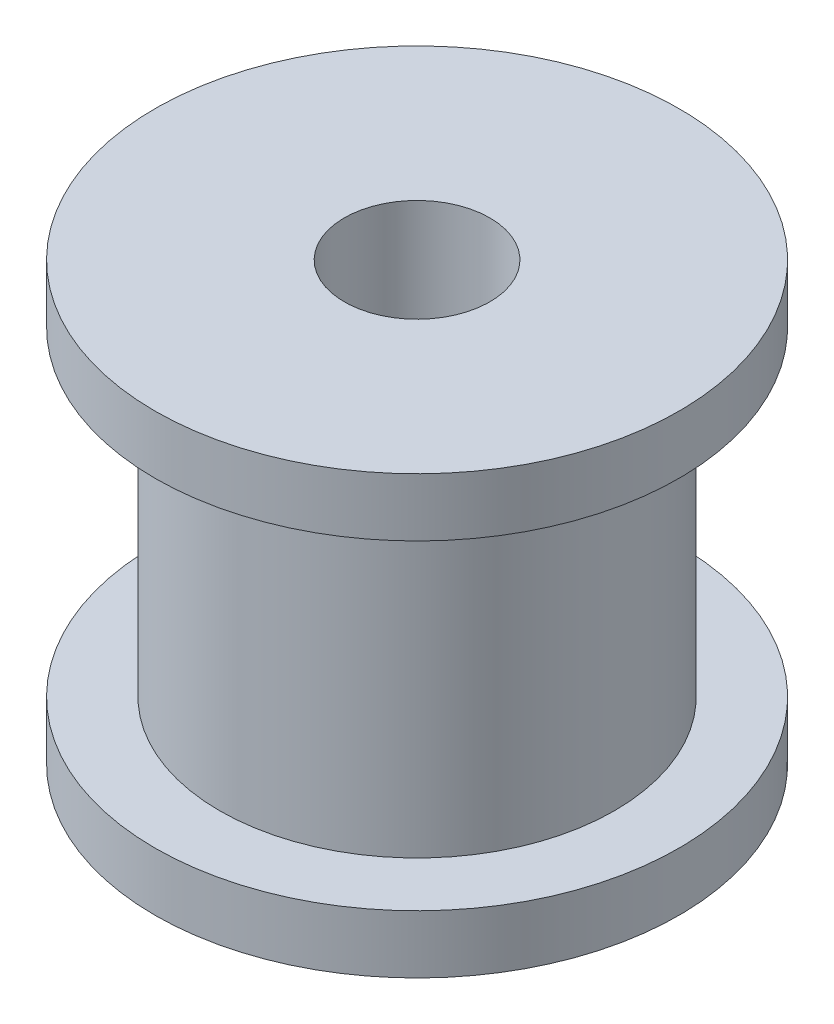
from build123d import *

# Parameters (mm, degrees)
SKETCH_1_R          = 9
EXTRUDE_1_DEPTH     = 2
SKETCH_2_R          = 6.78
EXTRUDE_2_DEPTH     = 11
SKETCH_3_R          = 9
EXTRUDE_3_DEPTH     = 2
SKETCH_5_R          = 2.5
CUT_EXTRUDE_1_DEPTH = 20.672315573


with BuildPart() as part:
    # 草图1 → 凸台-拉伸1 (new body)
    with BuildSketch(Plane(origin=(0, 0, 0), x_dir=(1, 0, 0), z_dir=(0, 1, 0))):
        with Locations(Location((0, 0, 0), (0, 0, 270))):
            Circle(SKETCH_1_R)
    extrude(amount=EXTRUDE_1_DEPTH)

    # 草图2 → 凸台-拉伸2 (add)
    with BuildSketch(Plane(origin=(0, 2, 0), x_dir=(1, 0, 0), z_dir=(0, 1, 0))):
        with Locations(Location((0, 0, 0), (0, 0, 270))):
            Circle(SKETCH_2_R)
    extrude(amount=EXTRUDE_2_DEPTH)

    # 草图3 → 凸台-拉伸3 (add)
    with BuildSketch(Plane(origin=(0, 13, 0), x_dir=(1, 0, 0), z_dir=(0, 1, 0))):
        with Locations(Location((0, 0, 0), (0, 0, 270))):
            Circle(SKETCH_3_R)
    extrude(amount=EXTRUDE_3_DEPTH)

    # 草图5 → 切除-拉伸1 (cut, through all)
    with BuildSketch(Plane.XZ):
        with Locations(Location((0, 0, 0), (0, 0, 270))):
            Circle(SKETCH_5_R)
    extrude(amount=-CUT_EXTRUDE_1_DEPTH, mode=Mode.SUBTRACT)


solid = part.part
